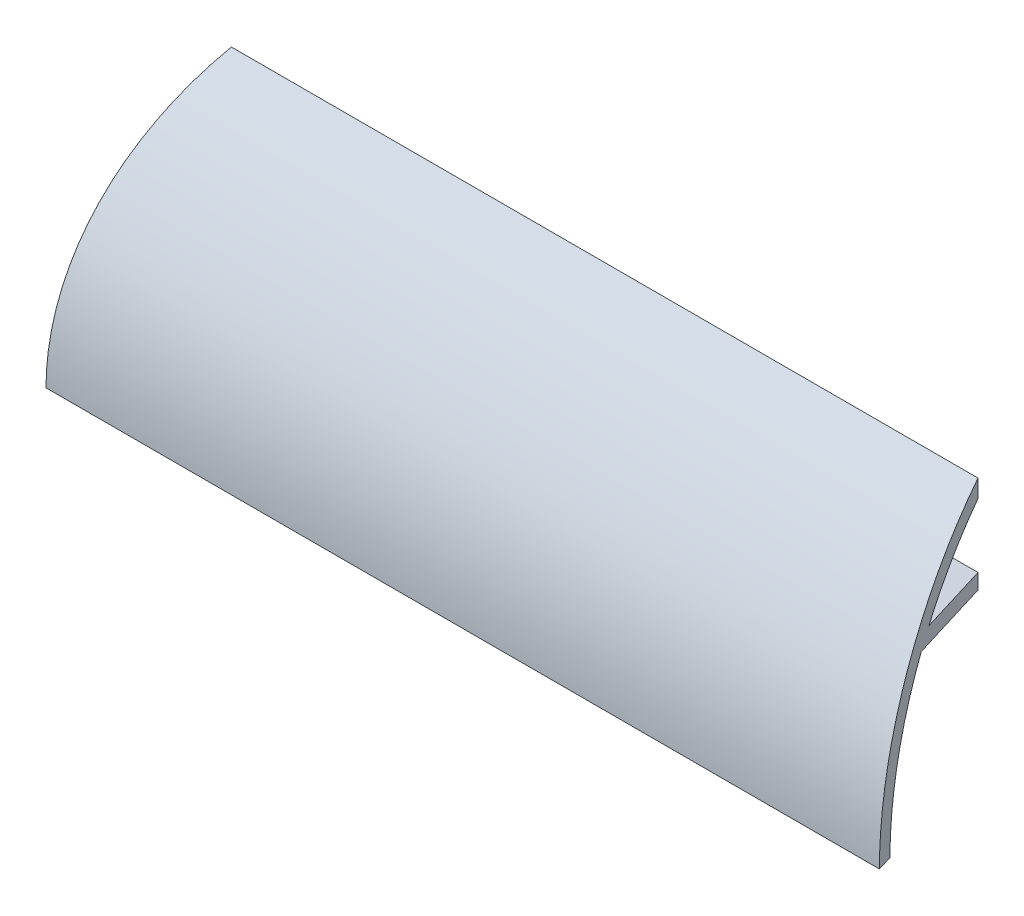
from build123d import *

# Parameters (mm, degrees)
BOSS_EXTRUDE1_DEPTH     = 13.15
CUT_EXTRUDE2_DEPTH      = 14.892246039
CUT_EXTRUDE2_DEPTH_BACK = 13
SKETCH2_OUTSIDE_W       = 17.928
SKETCH2_OUTSIDE_H       = 7.018


with BuildPart() as part:
    # Sketch1 → Boss-Extrude1 (new body)
    with BuildSketch(Plane(origin=(0, 0, 0), x_dir=(0, 0, -1), z_dir=(1, 0, 0))):
        with BuildLine():
            Line((0, 0), (0.24, 0))
            ThreePointArc((0.24, 0), (0.421575008, 1.227565185), (0.9507497, 2.35))
            Line((0.9507497, 2.35), (2.24, 2.35))
            Line((2.24, 2.35), (2.24, 2.59))
            Line((2.24, 2.59), (1.122898476, 2.59))
            ThreePointArc((1.122898476, 2.59), (1.636238533, 3.145094281), (2.24, 3.600198407))
            Line((2.24, 3.600198407), (2.24, 3.88))
            ThreePointArc((2.24, 3.88), (0.60020249, 2.240089284), (0, 0))
        make_face()
    extrude(amount=BOSS_EXTRUDE1_DEPTH)

    # Sketch2 outside → Cut-Extrude2 (cut, two sides: drawn at the far end of the back side and taken through both)
    with BuildSketch(Plane(origin=(0, 0, 0), x_dir=(1, 0, 0), z_dir=(0, 1, 0)).offset(-CUT_EXTRUDE2_DEPTH_BACK)):
        with Locations((6.575, 1.12)):
            Rectangle(SKETCH2_OUTSIDE_W, SKETCH2_OUTSIDE_H)
        Polygon((0.917192044, 3), (12.232807956, 3), (13.15, 0), (0, 0), align=None, mode=Mode.SUBTRACT)
    extrude(amount=CUT_EXTRUDE2_DEPTH + CUT_EXTRUDE2_DEPTH_BACK, mode=Mode.SUBTRACT)


solid = part.part
